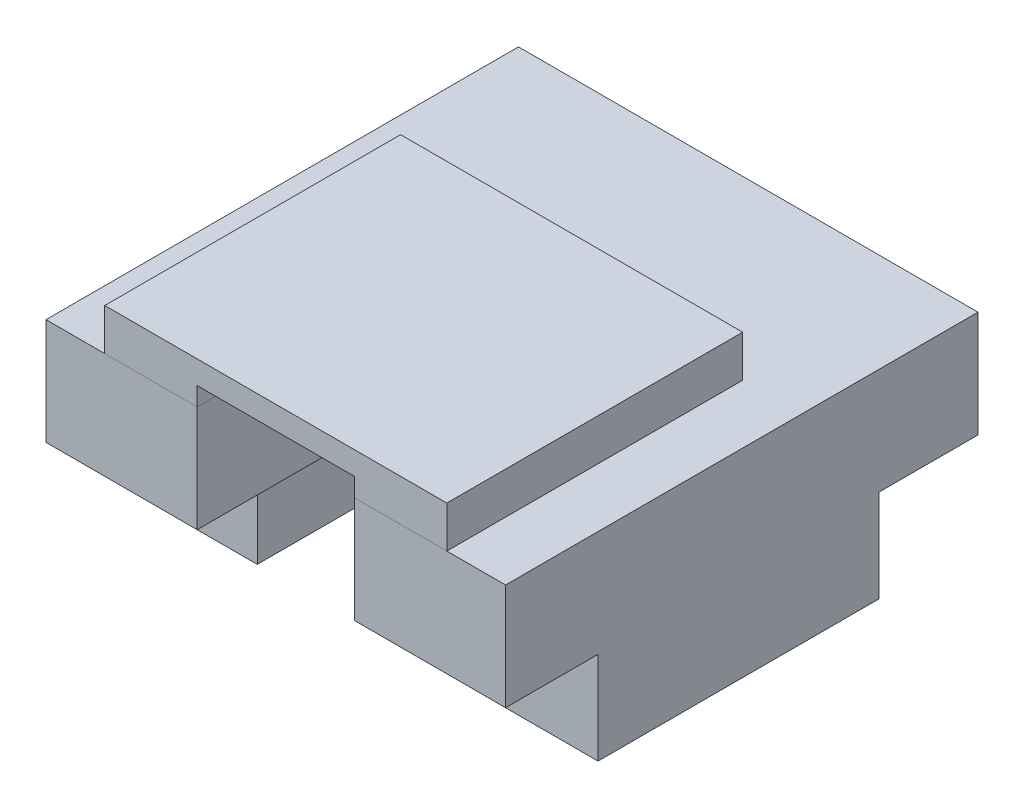
from build123d import *

# Parameters (mm, degrees)
SKETCH1_W           = 24.85
SKETCH1_H           = 15.2
BOSS_EXTRUDE1_DEPTH = 5.75
SKETCH2_W           = 6.425
SKETCH2_H           = 15.2
BOSS_EXTRUDE2_DEPTH = 5
SKETCH3_W           = 24.85
SKETCH3_H           = 5.75
BOSS_EXTRUDE3_DEPTH = 5.35
SKETCH5_W           = 24.85
SKETCH5_H           = 5.75
BOSS_EXTRUDE4_DEPTH = 5
SKETCH6_W           = 8.5
SKETCH6_H           = 11
CUT_EXTRUDE2_DEPTH  = 5.75
SKETCH4_W           = 12
SKETCH4_H           = 1.5
CUT_EXTRUDE1_DEPTH  = 14.05
BOSS_EXTRUDE5_DEPTH = 1
SKETCH8_W           = 18.5
SKETCH8_H           = 16
BOSS_EXTRUDE6_DEPTH = 1.25


with BuildPart() as part:
    # Sketch1 → Boss-Extrude1 (new body)
    with BuildSketch(Plane(origin=(0, 0, 0), x_dir=(1, 0, 0), z_dir=(0, 1, 0))):
        Rectangle(SKETCH1_W, SKETCH1_H)
    extrude(amount=BOSS_EXTRUDE1_DEPTH)

    # Sketch2 → Boss-Extrude2 (add)
    with BuildSketch(Plane.XZ):
        with Locations((-9.2125, 0)):
            Rectangle(SKETCH2_W, SKETCH2_H)
        with Locations((9.2125, 0)):
            Rectangle(SKETCH2_W, SKETCH2_H)
    extrude(amount=BOSS_EXTRUDE2_DEPTH)

    # Sketch3 → Boss-Extrude3 (add)
    with BuildSketch(Plane(origin=(0, 0, -7.6), x_dir=(-1, 0, 0), z_dir=(0, 0, -1))):
        with Locations((0, 2.875)):
            Rectangle(SKETCH3_W, SKETCH3_H)
    extrude(amount=BOSS_EXTRUDE3_DEPTH)

    # Sketch5 → Boss-Extrude4 (add)
    with BuildSketch(Plane.XY.offset(7.6)):
        with Locations((0, 2.875)):
            Rectangle(SKETCH5_W, SKETCH5_H)
    extrude(amount=BOSS_EXTRUDE4_DEPTH)

    # Sketch6 → Cut-Extrude2 (cut)
    with BuildSketch(Plane(origin=(0, 5.75, 0), x_dir=(1, 0, 0), z_dir=(0, 1, 0))):
        with Locations((0, -7.1)):
            Rectangle(SKETCH6_W, SKETCH6_H)
    extrude(amount=-CUT_EXTRUDE2_DEPTH, mode=Mode.SUBTRACT)

    # Sketch4 → Cut-Extrude1 (cut)
    with BuildSketch(Plane(origin=(0, 0, -12.95), x_dir=(-1, 0, 0), z_dir=(0, 0, -1))):
        with Locations((0, 0.75)):
            Rectangle(SKETCH4_W, SKETCH4_H)
    extrude(amount=-CUT_EXTRUDE1_DEPTH, mode=Mode.SUBTRACT)


with BuildPart() as body_2:
    # Sketch7 → Boss-Extrude5 (new body)
    with BuildSketch(Plane(origin=(0, 5.75, 0), x_dir=(1, 0, 0), z_dir=(0, 1, 0))):
        Polygon((9.25, 3.4), (-9.25, 3.4), (-9.25, -12.6), (-4.25, -12.6), (-4.25, -1.6), (4.25, -1.6), (4.25, -12.6), (9.25, -12.6), align=None)
    extrude(amount=BOSS_EXTRUDE5_DEPTH)

    # Sketch8 → Boss-Extrude6 (add)
    with BuildSketch(Plane(origin=(0, 6.75, 0), x_dir=(1, 0, 0), z_dir=(0, 1, 0))):
        with Locations((0, -4.6)):
            Rectangle(SKETCH8_W, SKETCH8_H)
    extrude(amount=BOSS_EXTRUDE6_DEPTH)


solid = Compound([part.part, body_2.part])
